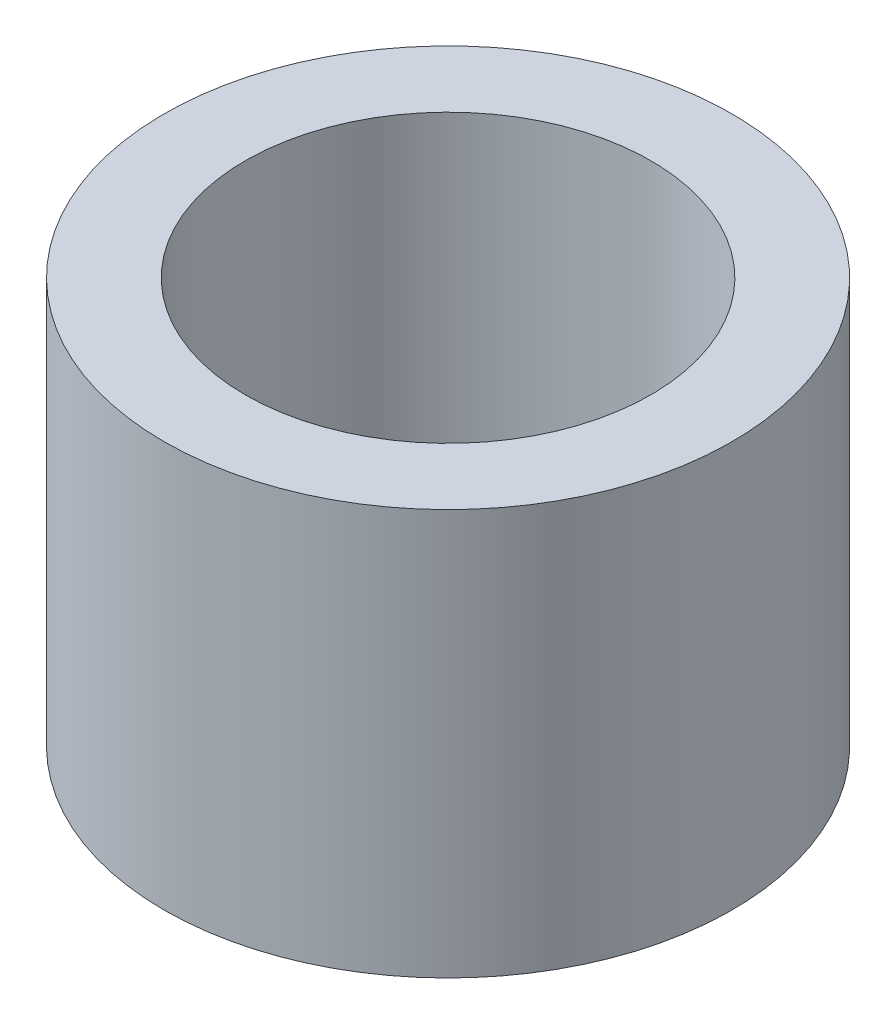
from build123d import *

# Parameters (mm, degrees)
SKETCH1_R           = 3.5
SKETCH1_R_2         = 2.5
BOSS_EXTRUDE1_DEPTH = 5


with BuildPart() as part:
    # Sketch1 → Boss-Extrude1 (new body)
    with BuildSketch(Plane(origin=(0, 0, 0), x_dir=(1, 0, 0), z_dir=(0, 1, 0))):
        with Locations(Location((0, 0, 0), (0, 0, 270))):
            Circle(SKETCH1_R)
        with Locations(Location((0, 0, 0), (0, 0, 270))):
            Circle(SKETCH1_R_2, mode=Mode.SUBTRACT)
    extrude(amount=BOSS_EXTRUDE1_DEPTH)


solid = part.part
